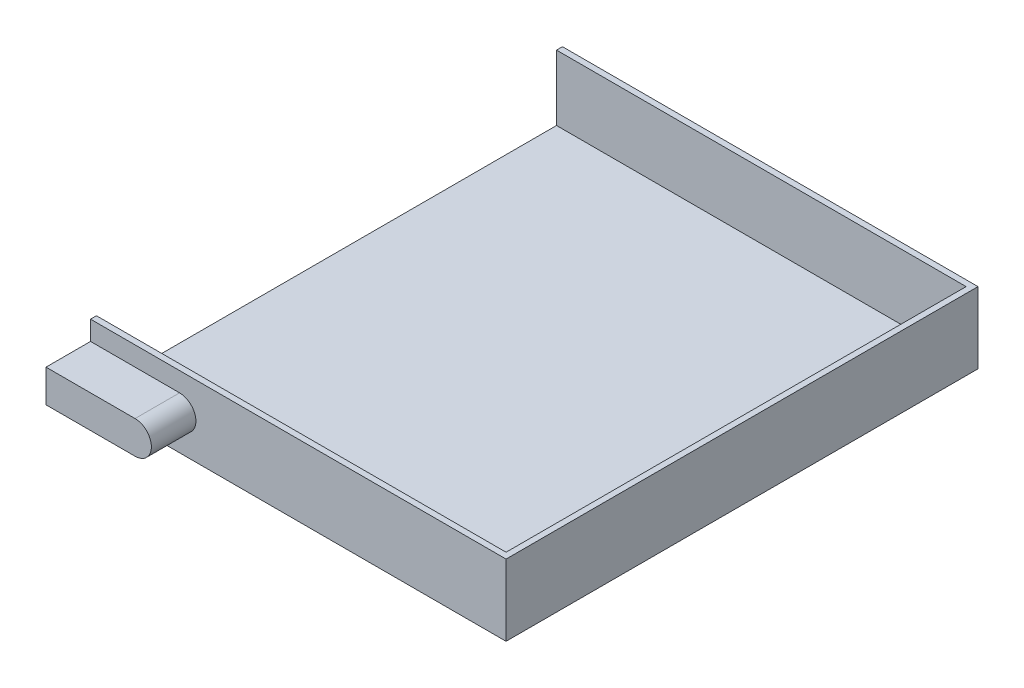
from build123d import *

# Parameters (mm, degrees)
SKETCH_1_W      = 138
SKETCH_1_H      = 155
EXTRUDE_1_DEPTH = 22
SHELL_1_T       = 2
EXTRUDE_3_DEPTH = 15


with BuildPart() as part:
    # 草图1 → 凸台-拉伸1 (new body)
    with BuildSketch(Plane(origin=(0, 0, 0), x_dir=(1, 0, 0), z_dir=(0, 1, 0))):
        with Locations((69, -77.5)):
            Rectangle(SKETCH_1_W, SKETCH_1_H)
    extrude(amount=EXTRUDE_1_DEPTH)

    # 抽壳1
    shell_1_openings = [part.faces().sort_by_distance(p)[0] for p in [
        (0, 11, 77.5),
        (69, 22, 77.5),
    ]]
    offset(amount=SHELL_1_T, openings=shell_1_openings, kind=Kind.INTERSECTION)

    # 草图4 → 凸台-拉伸3 (add)
    with BuildSketch(Plane.XY.offset(157)):
        with BuildLine():
            Line((30, 4.5), (0, 4.5))
            Line((0, 4.5), (0, 15.5))
            Line((0, 15.5), (30, 15.5))
            ThreePointArc((30, 15.5), (35.5, 10), (30, 4.5))
        make_face()
    extrude(amount=EXTRUDE_3_DEPTH)


solid = part.part
